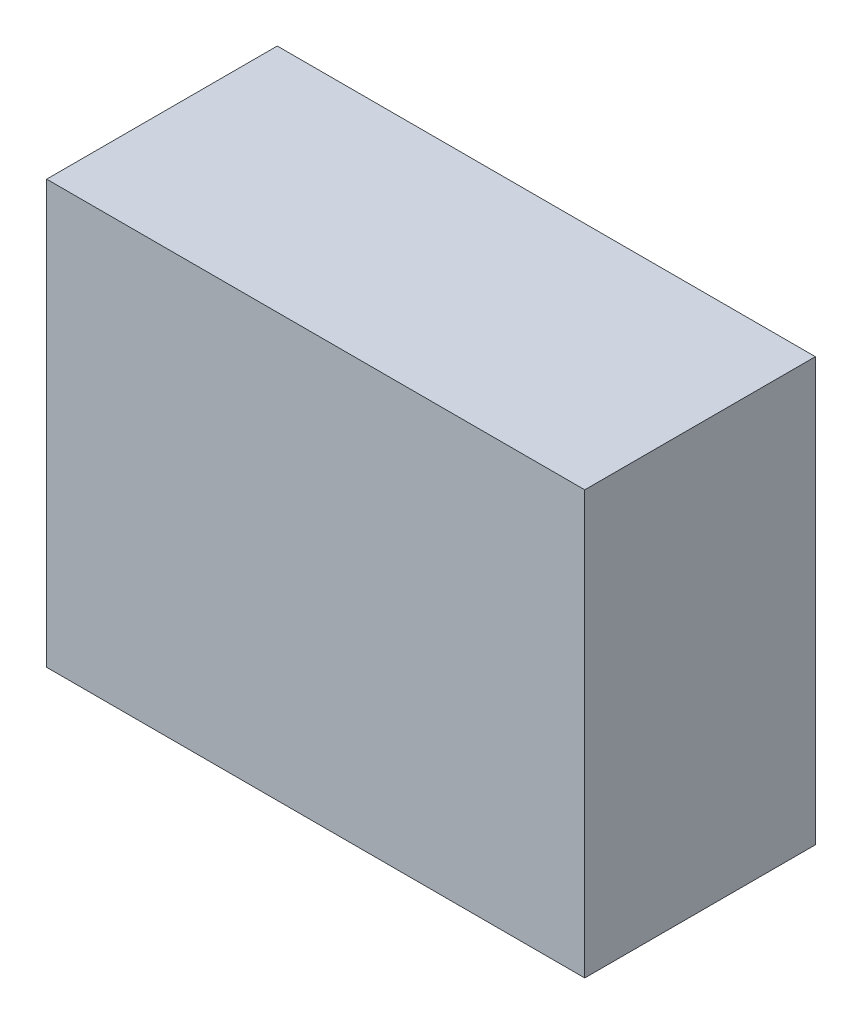
from build123d import *

# Parameters (mm, degrees)
SKETCH1_W           = 177.8
SKETCH1_H           = 76.2
BOSS_EXTRUDE1_DEPTH = 139.7


with BuildPart() as part:
    # Sketch1 → Boss-Extrude1 (new body)
    with BuildSketch(Plane(origin=(0, 0, 0), x_dir=(1, 0, 0), z_dir=(0, 1, 0))):
        with Locations((43.050847458, -4.358898305)):
            Rectangle(SKETCH1_W, SKETCH1_H)
    extrude(amount=BOSS_EXTRUDE1_DEPTH)


solid = part.part
